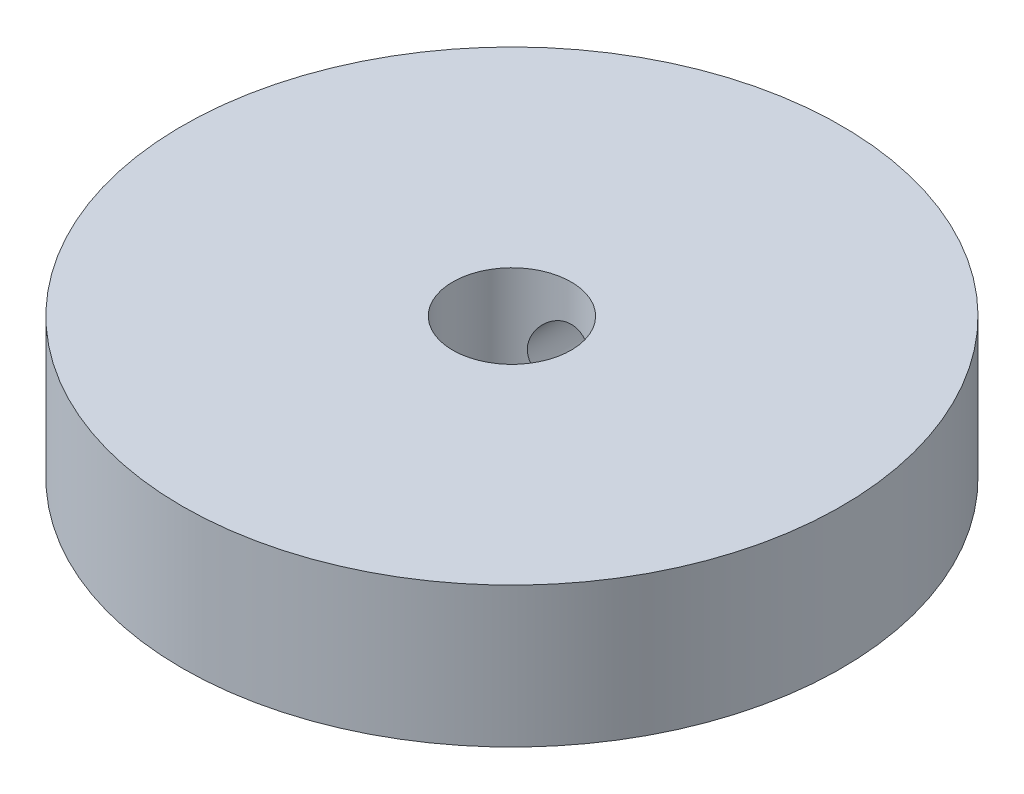
from build123d import *

# Parameters (mm, degrees)
SKETCH1_R           = 11.7475
SKETCH1_R_2         = 2.11
BOSS_EXTRUDE1_DEPTH = 2.5
SKETCH2_R           = 1.192853847
CUT_EXTRUDE1_DEPTH  = 17.800521197


with BuildPart() as part:
    # Sketch1 → Boss-Extrude1 (new, symmetric)
    with BuildSketch(Plane(origin=(0, 0, 0), x_dir=(1, 0, 0), z_dir=(0, 1, 0))):
        with Locations(Location((0, 0, 0), (0, 0, 270))):
            Circle(SKETCH1_R)
        with Locations(Location((0, 0, 0), (0, 0, 270))):
            Circle(SKETCH1_R_2, mode=Mode.SUBTRACT)
    extrude(amount=BOSS_EXTRUDE1_DEPTH, both=True)

    # Sketch2 → Cut-Extrude1 (cut, through all)
    with BuildSketch(Plane.XY):
        with Locations(Location((0, 0, 0), (0, 0, 90))):
            Circle(SKETCH2_R)
    extrude(amount=-CUT_EXTRUDE1_DEPTH, mode=Mode.SUBTRACT)


solid = part.part
